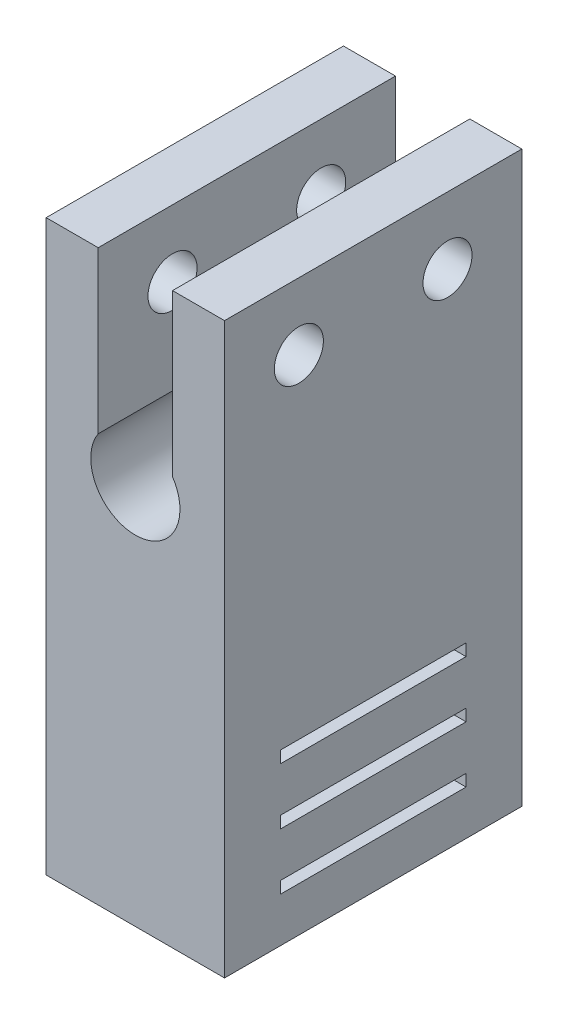
from build123d import *

# Parameters (mm, degrees)
SKIZZE1_W                       = 20
SKIZZE1_H                       = 38.3
SKIZZE1_R                       = 1.65
SKIZZE1_W_2                     = 12.5
SKIZZE1_H_2                     = 0.8
AUFSATZ_LINEAR_AUSTRAGEN1_DEPTH = 12
SCHNITT_LINEAR_AUSTRAGEN2_DEPTH = 45.842948164


with BuildPart() as part:
    # Skizze1 → Aufsatz-Linear austragen1 (new body)
    with BuildSketch(Plane(origin=(0, 0, 0), x_dir=(0, 0, -1), z_dir=(1, 0, 0))):
        with Locations((10, 19.15)):
            Rectangle(SKIZZE1_W, SKIZZE1_H)
        with Locations((5, 33.8)):
            Circle(SKIZZE1_R, mode=Mode.SUBTRACT)
        with Locations((15, 33.8)):
            Circle(SKIZZE1_R, mode=Mode.SUBTRACT)
        with Locations((10, 3.4)):
            Rectangle(SKIZZE1_W_2, SKIZZE1_H_2, mode=Mode.SUBTRACT)
        with Locations((10, 7.2)):
            Rectangle(SKIZZE1_W_2, SKIZZE1_H_2, mode=Mode.SUBTRACT)
        with Locations((10, 11)):
            Rectangle(SKIZZE1_W_2, SKIZZE1_H_2, mode=Mode.SUBTRACT)
    extrude(amount=AUFSATZ_LINEAR_AUSTRAGEN1_DEPTH)

    # Skizze2 → Schnitt-Linear austragen2 (cut, through all)
    with BuildSketch(Plane.XY):
        with BuildLine():
            Line((3.5, 38.3), (8.5, 38.3))
            Line((8.5, 38.3), (8.5, 27.458312395))
            ThreePointArc((8.5, 27.458312395), (6, 22.8), (3.5, 27.458312395))
            Line((3.5, 27.458312395), (3.5, 38.3))
        make_face()
    extrude(amount=-SCHNITT_LINEAR_AUSTRAGEN2_DEPTH, mode=Mode.SUBTRACT)


solid = part.part
